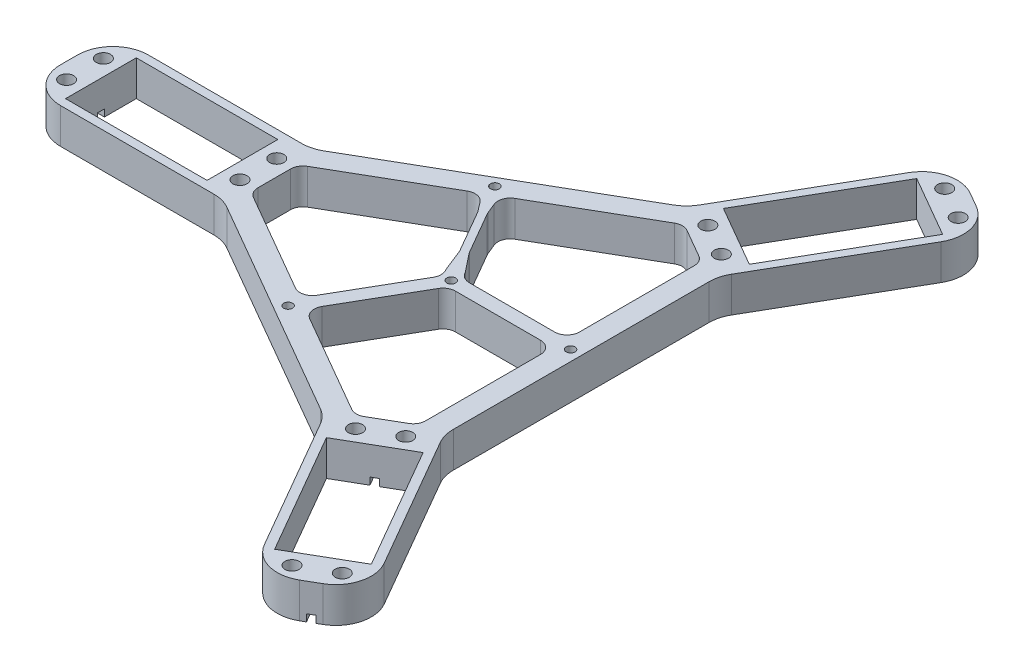
from build123d import *

# Parameters (mm, degrees)
SKETCH1_R           = 2
SKETCH1_R_2         = 1.25
SKETCH1_W           = 40
SKETCH1_H           = 20
BOSS_EXTRUDE1_DEPTH = 10
SKETCH2_W           = 2
SKETCH2_H           = 4
CUT_EXTRUDE1_DEPTH  = 56
SKETCH3_W           = 2
SKETCH3_H           = 4
CUT_EXTRUDE2_DEPTH  = 56
SKETCH4_W           = 2
SKETCH4_H           = 4
CUT_EXTRUDE3_DEPTH  = 56
FILLET1_R           = 10
FILLET2_R           = 3.5


with BuildPart() as part:
    # Sketch1 → Boss-Extrude1 (new body)
    with BuildSketch(Plane(origin=(0, 0, 0), x_dir=(1, 0, 0), z_dir=(0, 1, 0))):
        Polygon((-9, 22.4), (-9, -2.4), (47, -2.4), (114.261284993, -41.233320997), (142.261284993, -89.730743609), (163.738715007, -77.330743609), (135.738715007, -28.833320997), (135.738715007, 48.833320997), (163.738715007, 97.330743609), (142.261284993, 109.730743609), (114.261284993, 61.233320997), (47, 22.4), align=None)
        with Locations(Location((-4.5, 4.8, 0), (0, 0, 270))):
            Circle(SKETCH1_R, mode=Mode.SUBTRACT)
        with Locations(Location((44.5, 4.8, 0), (0, 0, 270))):
            Circle(SKETCH1_R, mode=Mode.SUBTRACT)
        with Locations(Location((146.2466679, -82.233629292, 0), (0, 0, 270))):
            Circle(SKETCH1_R, mode=Mode.SUBTRACT)
        with Locations(Location((155.2533321, -77.033629292, 0), (0, 0, 270))):
            Circle(SKETCH1_R, mode=Mode.SUBTRACT)
        with Locations(Location((121.7466679, -39.798384506, 0), (0, 0, 270))):
            Circle(SKETCH1_R, mode=Mode.SUBTRACT)
        Polygon((157.160254038, -70.736514975), (139.839745962, -80.736514975), (119.839745962, -46.095498823), (137.160254038, -36.095498823), align=None, mode=Mode.SUBTRACT)
        with Locations(Location((82.130642497, -19.218584287, 0), (0, 0, 270))):
            Circle(SKETCH1_R_2, mode=Mode.SUBTRACT)
        Polygon((85.362693304, -17.620508076), (100.154700538, 8), (129.738715007, 8), (129.738715007, -29.988021535), (118.261284993, -36.614518843), align=None, mode=Mode.SUBTRACT)
        with Locations(Location((130.7533321, -34.598384506, 0), (0, 0, 270))):
            Circle(SKETCH1_R, mode=Mode.SUBTRACT)
        with Locations(Location((-4.5, 15.2, 0), (0, 0, 270))):
            Circle(SKETCH1_R, mode=Mode.SUBTRACT)
        with Locations((20, 10)):
            Rectangle(SKETCH1_W, SKETCH1_H, mode=Mode.SUBTRACT)
        with Locations(Location((44.5, 15.2, 0), (0, 0, 270))):
            Circle(SKETCH1_R, mode=Mode.SUBTRACT)
        Polygon((95.535898385, 12), (96.690598923, 10), (81.898591689, -15.620508076), (49, 3.373502692), (49, 16.626497308), (82.014634361, 35.687505343), (85.99611255, 30.523393759), (93.064765898, 18.280127019), align=None, mode=Mode.SUBTRACT)
        with Locations(Location((99, 10, 0), (0, 0, 270))):
            Circle(SKETCH1_R_2, mode=Mode.SUBTRACT)
        with Locations(Location((82.130642497, 39.218584287, 0), (0, 0, 270))):
            Circle(SKETCH1_R_2, mode=Mode.SUBTRACT)
        Polygon((129.738715007, 49.988021535), (129.738715007, 12), (100.154700538, 12), (99, 14), (94.796816706, 19.280127019), (87.728163358, 31.523393759), (85.246650633, 37.553510808), (118.261284993, 56.614518843), align=None, mode=Mode.SUBTRACT)
        with Locations(Location((132.738715007, 10, 0), (0, 0, 270))):
            Circle(SKETCH1_R_2, mode=Mode.SUBTRACT)
        with Locations(Location((130.7533321, 54.598384506, 0), (0, 0, 270))):
            Circle(SKETCH1_R, mode=Mode.SUBTRACT)
        with Locations(Location((121.7466679, 59.798384506, 0), (0, 0, 270))):
            Circle(SKETCH1_R, mode=Mode.SUBTRACT)
        Polygon((119.839745962, 66.095498823), (139.839745962, 100.736514975), (157.160254038, 90.736514975), (137.160254038, 56.095498823), align=None, mode=Mode.SUBTRACT)
        with Locations(Location((146.2466679, 102.233629292, 0), (0, 0, 270))):
            Circle(SKETCH1_R, mode=Mode.SUBTRACT)
        with Locations(Location((155.2533321, 97.033629292, 0), (0, 0, 270))):
            Circle(SKETCH1_R, mode=Mode.SUBTRACT)
    extrude(amount=BOSS_EXTRUDE1_DEPTH)

    # Sketch2 → Cut-Extrude1 (cut)
    with BuildSketch(Plane.ZY.offset(9)):
        with Locations((-10, 0)):
            Rectangle(SKETCH2_W, SKETCH2_H)
    extrude(amount=-CUT_EXTRUDE1_DEPTH, mode=Mode.SUBTRACT)

    # Sketch3 → Cut-Extrude2 (cut)
    with BuildSketch(Plane(origin=(74.419872981, 0, 128.899001096), x_dir=(0.8660254037844434, 0, -0.49999999999999173), z_dir=(0.49999999999999173, 0, 0.8660254037844434))):
        with Locations((90.736514975, 0)):
            Rectangle(SKETCH3_W, SKETCH3_H)
    extrude(amount=-CUT_EXTRUDE2_DEPTH, mode=Mode.SUBTRACT)

    # Sketch4 → Cut-Extrude3 (cut)
    with BuildSketch(Plane(origin=(83.080127019, 0, -143.899001096), x_dir=(-0.8660254037844363, 0, -0.5000000000000043), z_dir=(0.5000000000000043, 0, -0.8660254037844363))):
        with Locations((-80.736514975, 0)):
            Rectangle(SKETCH4_W, SKETCH4_H)
    extrude(amount=-CUT_EXTRUDE3_DEPTH, mode=Mode.SUBTRACT)

    # Fillet1
    fillet1_edges = [part.edges().sort_by_distance(p)[0] for p in [
        (135.738715007, 5, 28.833320997),
        (163.738715007, 5, 77.330743609),
        (142.261284993, 5, 89.730743609),
        (114.261284993, 5, 41.233320997),
        (47, 5, 2.4),
        (-9, 5, 2.4),
        (-9, 5, -22.4),
        (47, 5, -22.4),
        (114.261284993, 5, -61.233320997),
        (142.261284993, 5, -109.730743609),
        (163.738715007, 5, -97.330743609),
        (135.738715007, 5, -48.833320997),
    ]]
    fillet(fillet1_edges, radius=FILLET1_R)

    # Fillet2
    fillet2_edges = [part.edges().sort_by_distance(p)[0] for p in [
        (49, 5, -16.626497308),
        (49, 5, -3.373502692),
        (81.898591689, 5, 15.620508076),
        (96.690598923, 5, -10),
        (95.535898385, 5, -12),
        (93.064765898, 5, -18.280127019),
        (85.99611255, 5, -30.523393759),
        (82.014634361, 5, -35.687505343),
        (87.728163358, 5, -31.523393759),
        (94.796816706, 5, -19.280127019),
        (99, 5, -14),
        (100.154700538, 5, -12),
        (129.738715007, 5, -12),
        (129.738715007, 5, -49.988021535),
        (118.261284993, 5, -56.614518843),
        (85.246650633, 5, -37.553510808),
        (100.154700538, 5, -8),
        (85.362693304, 5, 17.620508076),
        (118.261284993, 5, 36.614518843),
        (129.738715007, 5, 29.988021535),
        (129.738715007, 5, -8),
    ]]
    fillet(fillet2_edges, radius=FILLET2_R)


solid = part.part
